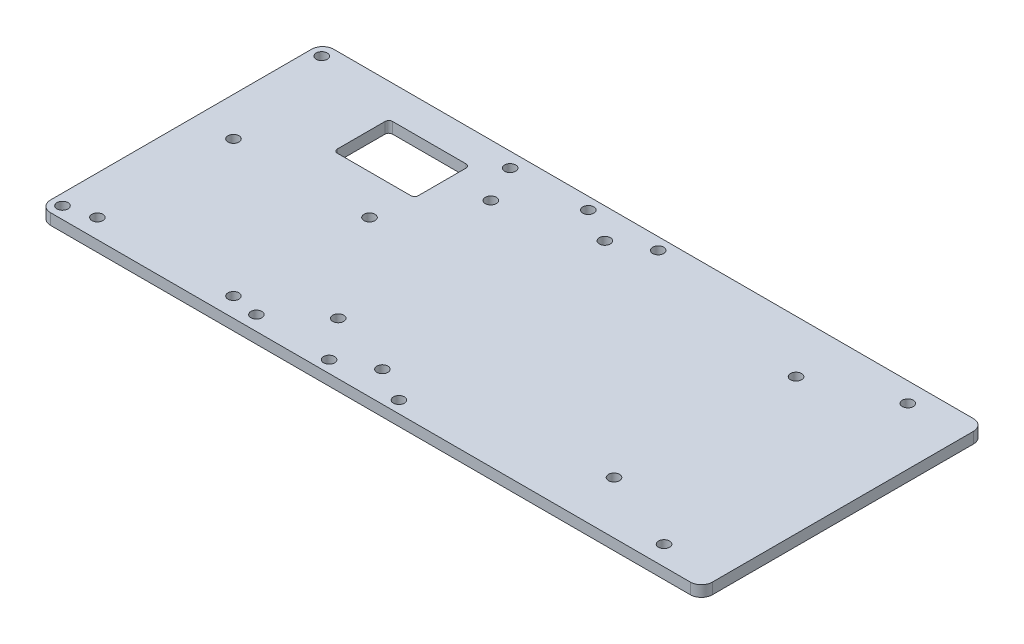
from build123d import *

# Parameters (mm, degrees)
SKETCH1_W           = 180
SKETCH1_H           = 77
SKETCH1_R           = 1.5
SKETCH1_R_2         = 1.500742376
BOSS_EXTRUDE1_DEPTH = 3
FILLET1_R           = 3
CUT_EXTRUDE1_DEPTH  = 3
SKETCH3_R           = 1.5
CUT_EXTRUDE2_DEPTH  = 3
SKETCH4_R           = 1.5
CUT_EXTRUDE3_DEPTH  = 3
SKETCH5_W           = 20
SKETCH5_H           = 34
BOSS_EXTRUDE2_DEPTH = 20
SKETCH6_R           = 1.5
CUT_EXTRUDE4_DEPTH  = 3


with BuildPart() as part:
    # Sketch1 → Boss-Extrude1 (new body)
    with BuildSketch(Plane(origin=(0, 0, 0), x_dir=(1, 0, 0), z_dir=(0, 1, 0))):
        Rectangle(SKETCH1_W, SKETCH1_H)
        with Locations(Location((-87, 35.25, 0), (0, 0, 270))):
            Circle(SKETCH1_R, mode=Mode.SUBTRACT)
        with Locations(Location((-87, -35.25, 0), (0, 0, 90))):
            Circle(SKETCH1_R, mode=Mode.SUBTRACT)
        with Locations(Location((-35.005408935, 34.5, 0), (0, 0, 270))):
            Circle(SKETCH1_R, mode=Mode.SUBTRACT)
        with Locations(Location((-35.005408935, -34.5, 0), (0, 0, 90))):
            Circle(SKETCH1_R, mode=Mode.SUBTRACT)
        with Locations(Location((74.494591065, 33.15, 0), (0, 0, 270))):
            Circle(SKETCH1_R_2, mode=Mode.SUBTRACT)
        with Locations(Location((74.494591065, -33.15, 0), (0, 0, 270))):
            Circle(SKETCH1_R, mode=Mode.SUBTRACT)
    extrude(amount=BOSS_EXTRUDE1_DEPTH)

    # Fillet1
    fillet1_edges = [part.edges().sort_by_distance(p)[0] for p in [
        (90, 1.5, 38.5),
        (-90, 1.5, 38.5),
        (-90, 1.5, -38.5),
        (90, 1.5, -38.5),
    ]]
    fillet(fillet1_edges, radius=FILLET1_R)

    # Sketch2 → Cut-Extrude1 (cut)
    with BuildSketch(Plane(origin=(0, 3, 0), x_dir=(1, 0, 0), z_dir=(0, 1, 0))):
        with BuildLine():
            Line((-62, 14.5), (-42, 14.5))
            ThreePointArc((-42, 14.5), (-41.292893219, 14.792893219), (-41, 15.5))
            Line((-41, 15.5), (-41, 28.5))
            ThreePointArc((-41, 28.5), (-41.292893219, 29.207106781), (-42, 29.5))
            Line((-42, 29.5), (-62, 29.5))
            ThreePointArc((-62, 29.5), (-62.707106781, 29.207106781), (-63, 28.5))
            Line((-63, 28.5), (-63, 15.5))
            ThreePointArc((-63, 15.5), (-62.707106781, 14.792893219), (-62, 14.5))
        make_face()
    extrude(amount=-CUT_EXTRUDE1_DEPTH, mode=Mode.SUBTRACT)

    # Sketch3 → Cut-Extrude2 (cut)
    with BuildSketch(Plane(origin=(0, 3, 0), x_dir=(1, 0, 0), z_dir=(0, 1, 0))):
        with Locations(Location((-79.5, 3.75, 0), (0, 0, 270))):
            Circle(SKETCH3_R)
        with Locations(Location((-42.5, 3.75, 0), (0, 0, 270))):
            Circle(SKETCH3_R)
        with Locations(Location((-42.5, -33.25, 0), (0, 0, 270))):
            Circle(SKETCH3_R)
        with Locations(Location((-79.5, -33.25, 0), (0, 0, 270))):
            Circle(SKETCH3_R)
    extrude(amount=-CUT_EXTRUDE2_DEPTH, mode=Mode.SUBTRACT)

    # Sketch4 → Cut-Extrude3 (cut)
    with BuildSketch(Plane(origin=(0, 3, 0), x_dir=(1, 0, 0), z_dir=(0, 1, 0))):
        with Locations(Location((-30.005408935, 24.25, 0), (0, 0, 270))):
            Circle(SKETCH4_R)
        with Locations(Location((52.994591065, 24.25, 0), (0, 0, 270))):
            Circle(SKETCH4_R)
        with Locations(Location((51.994591065, -24.25, 0), (0, 0, 270))):
            Circle(SKETCH4_R)
        with Locations(Location((-23.005408935, -24.25, 0), (0, 0, 270))):
            Circle(SKETCH4_R)
    extrude(amount=-CUT_EXTRUDE3_DEPTH, mode=Mode.SUBTRACT)

    # Sketch5 → Boss-Extrude2 (add)
    with BuildSketch(Plane.XZ):
        with Locations((40, 1.5)):
            Rectangle(SKETCH5_W, SKETCH5_H)
    extrude(amount=BOSS_EXTRUDE2_DEPTH)

    # Sketch6 → Cut-Extrude4 (cut)
    with BuildSketch(Plane.XZ):
        with Locations(Location((-14.5, -35.25, 0), (0, 0, 270))):
            Circle(SKETCH6_R)
        with Locations(Location((4.5, -35.25, 0), (0, 0, 270))):
            Circle(SKETCH6_R)
        with Locations(Location((4.5, 35.25, 0), (0, 0, 270))):
            Circle(SKETCH6_R)
        with Locations(Location((-14.5, 35.25, 0), (0, 0, 270))):
            Circle(SKETCH6_R)
        with Locations(Location((-5, -30.25, 0), (0, 0, 270))):
            Circle(SKETCH6_R)
        with Locations(Location((-5, 30.25, 0), (0, 0, 270))):
            Circle(SKETCH6_R)
    extrude(amount=-CUT_EXTRUDE4_DEPTH, mode=Mode.SUBTRACT)


solid = part.part
